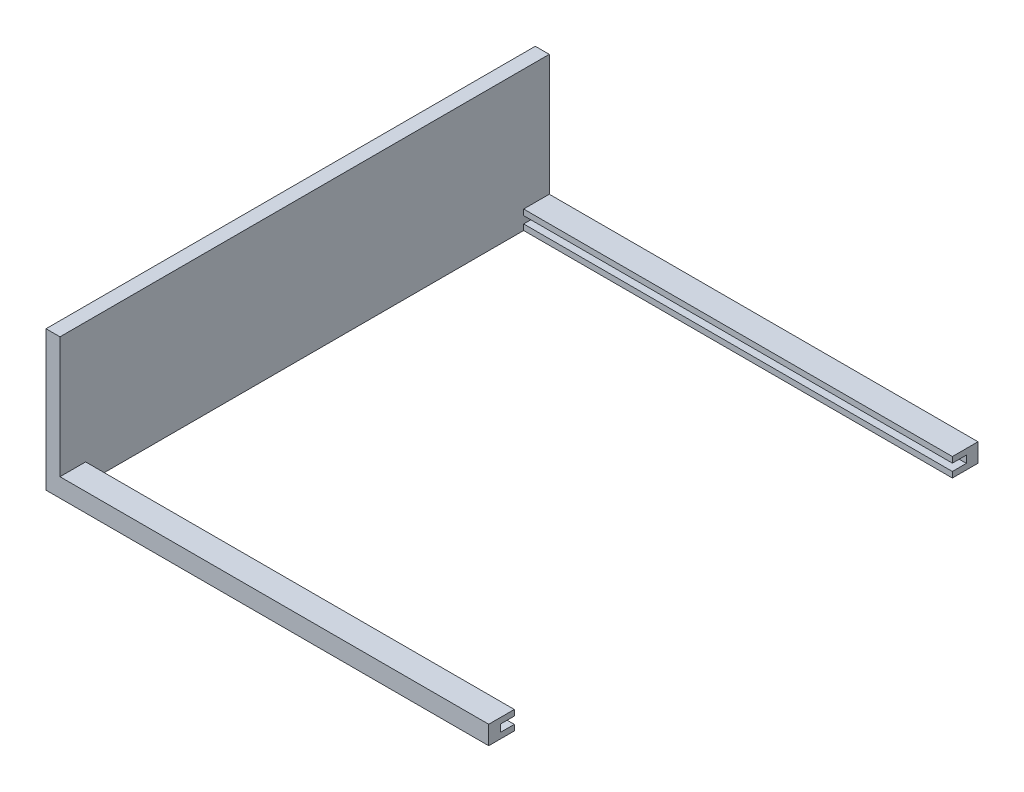
from build123d import *

# Parameters (mm, degrees)
BOSS_EXTRUDE1_DEPTH = 105
CUT_EXTRUDE1_DEPTH  = 100


with BuildPart() as part:
    # Sketch1 → Boss-Extrude1 (new body)
    with BuildSketch(Plane.XY):
        Polygon((0, 26), (0, 0), (92, 0), (92, -4), (-3, -4), (-3, 26), align=None)
    extrude(amount=-BOSS_EXTRUDE1_DEPTH)

    # Sketch2 → Cut-Extrude1 (cut)
    with BuildSketch(Plane(origin=(0, 0, 0), x_dir=(0, 0, -1), z_dir=(1, 0, 0))):
        Polygon((99.5, -1.23), (102.5, -1.23), (102.5, -2.77), (99.5, -2.77), (99.5, -4), (5.5, -4), (5.5, -2.77), (2.5, -2.77), (2.5, -1.23), (5.5, -1.23), (5.5, 0), (99.5, 0), align=None)
    extrude(amount=CUT_EXTRUDE1_DEPTH, mode=Mode.SUBTRACT)


solid = part.part
